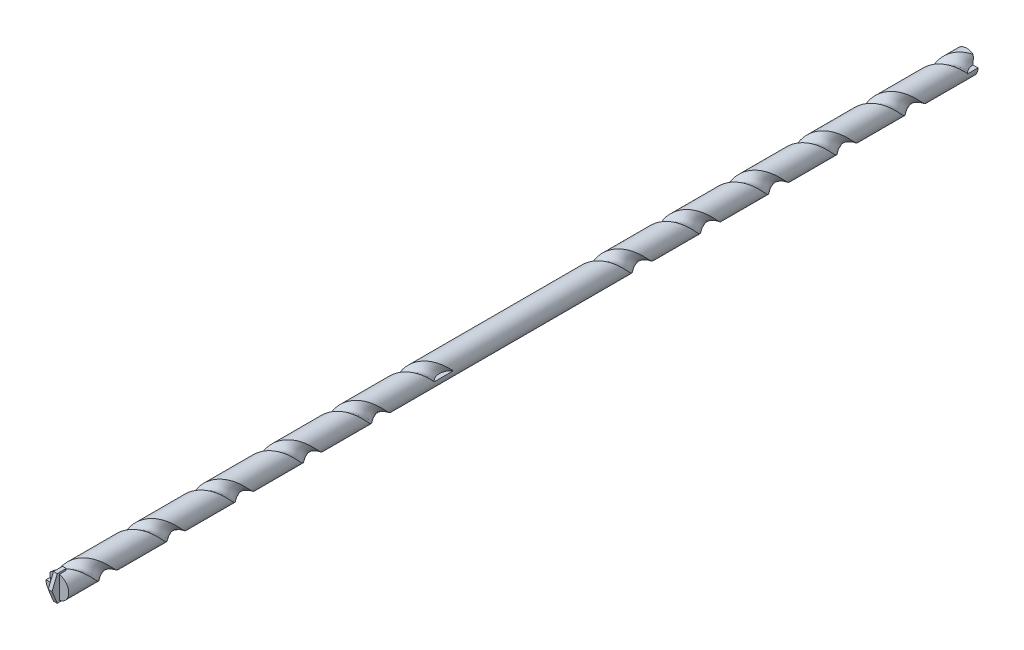
from build123d import *

# Parameters (mm, degrees)
SKETCH1_R           = 30
BOSS_EXTRUDE1_DEPTH = 1200
CUT_SWEEP1_PITCH    = 180
CUT_SWEEP1_HEIGHT   = 990
CUT_SWEEP1_RADIUS   = 50
SKETCH3_R           = 32
BOSS_EXTRUDE2_START = 1200
SKETCH4_R           = 30
BOSS_EXTRUDE2_DEPTH = 1200
CUT_SWEEP2_PITCH    = 180
CUT_SWEEP2_HEIGHT   = 990
CUT_SWEEP2_RADIUS   = 51.555485526
SKETCH6_R           = 34.721189294
BOSS_EXTRUDE3_DEPTH = 5


with BuildPart() as part:
    # Sketch1 → Boss-Extrude1 (new body)
    with BuildSketch(Plane.XY):
        Circle(SKETCH1_R)
    extrude(amount=BOSS_EXTRUDE1_DEPTH)

    # Cut-Sweep1: sweep along a helix
    with BuildLine() as cut_sweep1_path:
        Helix(CUT_SWEEP1_PITCH, CUT_SWEEP1_HEIGHT, CUT_SWEEP1_RADIUS, center=(0, 0, 1200), direction=(0, 0, -1))
    # Sketch3 → Cut-Sweep1 (sweep, cut)
    with BuildSketch(Plane(origin=(0, 0, 0), x_dir=(0, 0, -1), z_dir=(1, 0, 0))):
        with Locations((-795.098045137, 49.999579693)):
            Circle(SKETCH3_R)
    sweep(path=cut_sweep1_path.line, is_frenet=True, mode=Mode.SUBTRACT)

    # Sketch4 → Boss-Extrude2 (add)
    with BuildSketch(Plane(origin=(0, 0, 0), x_dir=(-1, 0, 0), z_dir=(0, 0, -1)).offset(BOSS_EXTRUDE2_START)):
        Circle(SKETCH4_R)
    extrude(amount=-BOSS_EXTRUDE2_DEPTH)

    # Cut-Sweep2: sweep along a helix
    with BuildLine() as cut_sweep2_path:
        Helix(CUT_SWEEP2_PITCH, CUT_SWEEP2_HEIGHT, CUT_SWEEP2_RADIUS, center=(0, 0, -1200), direction=(0, 0, 1))
    # Sketch6 → Cut-Sweep2 (sweep, cut)
    with BuildSketch(Plane(origin=(0, 0, 0), x_dir=(0, 0, -1), z_dir=(1, 0, 0))):
        with Locations((795.166462774, 51.554458495)):
            Circle(SKETCH6_R)
    sweep(path=cut_sweep2_path.line, is_frenet=True, mode=Mode.SUBTRACT)

    # Sketch7 → Boss-Extrude3 (add, symmetric)
    with BuildSketch(Plane(origin=(0, 0, 0), x_dir=(0, 0, -1), z_dir=(1, 0, 0))):
        Polygon((-1181.56890664, -33.961746138), (-1181.56890664, 33.961746138), (-1205.349547141, 33.961746138), (-1219.082029684, 0), (-1205.349547141, -33.961746138), align=None)
    extrude(amount=BOSS_EXTRUDE3_DEPTH, both=True)


solid = part.part
